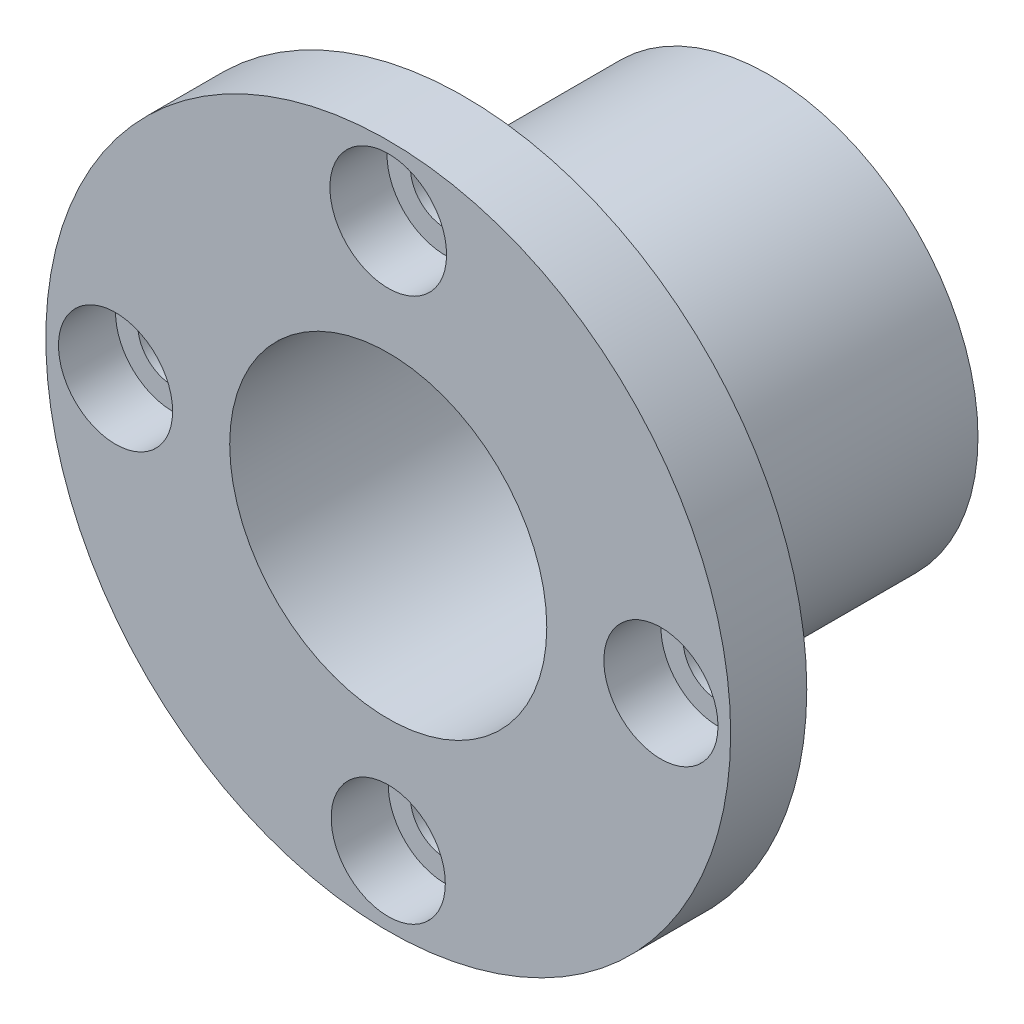
from build123d import *
from build123d.topology import SkipClean

# Parameters (mm, degrees)
SKETCH_1_R          = 27
SKETCH_1_R_2        = 12.5
EXTRUDE_3_DEPTH     = 6
EXTRUDE_START       = 24
SKETCH_2_R          = 16.5
SKETCH_2_R_2        = 12.5
EXTRUDE_4_DEPTH     = 24
SKETCH_3_R          = 2.75
CUT_EXTRUDE_1_DEPTH = 24
SKETCH_4_R          = 4.6
SKETCH_4_R_2        = 4.5
CUT_EXTRUDE_2_DEPTH = 4.5


with BuildPart() as part:
    # 草图1 → 凸台-拉伸3 (new body)
    with BuildSketch(Plane.XY):
        Circle(SKETCH_1_R)
        Circle(SKETCH_1_R_2, mode=Mode.SUBTRACT)
    extrude(amount=EXTRUDE_3_DEPTH)

    # 草图2 → 凸台-拉伸4 (add)
    with SkipClean():  # the faces are left unmerged after this step: merging them gives an invalid solid
        with BuildSketch(Plane(origin=(0, 0, 0), x_dir=(-1, 0, 0), z_dir=(0, 0, -1)).offset(EXTRUDE_START)):
            with Locations(Location((0, 0, 0), (0, 0, 180))):
                Circle(SKETCH_2_R)
            Circle(SKETCH_2_R_2, mode=Mode.SUBTRACT)
        extrude(amount=-EXTRUDE_4_DEPTH)

    # 草图3 → 切除-拉伸1 (cut)
    with SkipClean():  # the faces are left unmerged after this step: merging them gives an invalid solid
        with BuildSketch(Plane.XY.offset(6)):
            with Locations((0, 21.5)):
                Circle(SKETCH_3_R)
            with Locations((21.5, 0)):
                Circle(SKETCH_3_R)
            with Locations((0, -21.5)):
                Circle(SKETCH_3_R)
            with Locations((-21.5, 0)):
                Circle(SKETCH_3_R)
        extrude(amount=-CUT_EXTRUDE_1_DEPTH, mode=Mode.SUBTRACT)

    # 草图4 → 切除-拉伸2 (cut)
    with SkipClean():  # the faces are left unmerged after this step: merging them gives an invalid solid
        with BuildSketch(Plane.XY.offset(6)):
            with Locations((0, 21.5)):
                Circle(SKETCH_4_R)
            with Locations((21.5, 0)):
                Circle(SKETCH_4_R_2)
            with Locations((0, -21.5)):
                Circle(SKETCH_4_R_2)
            with Locations((-21.5, 0)):
                Circle(SKETCH_4_R_2)
        extrude(amount=-CUT_EXTRUDE_2_DEPTH, mode=Mode.SUBTRACT)


solid = part.part
